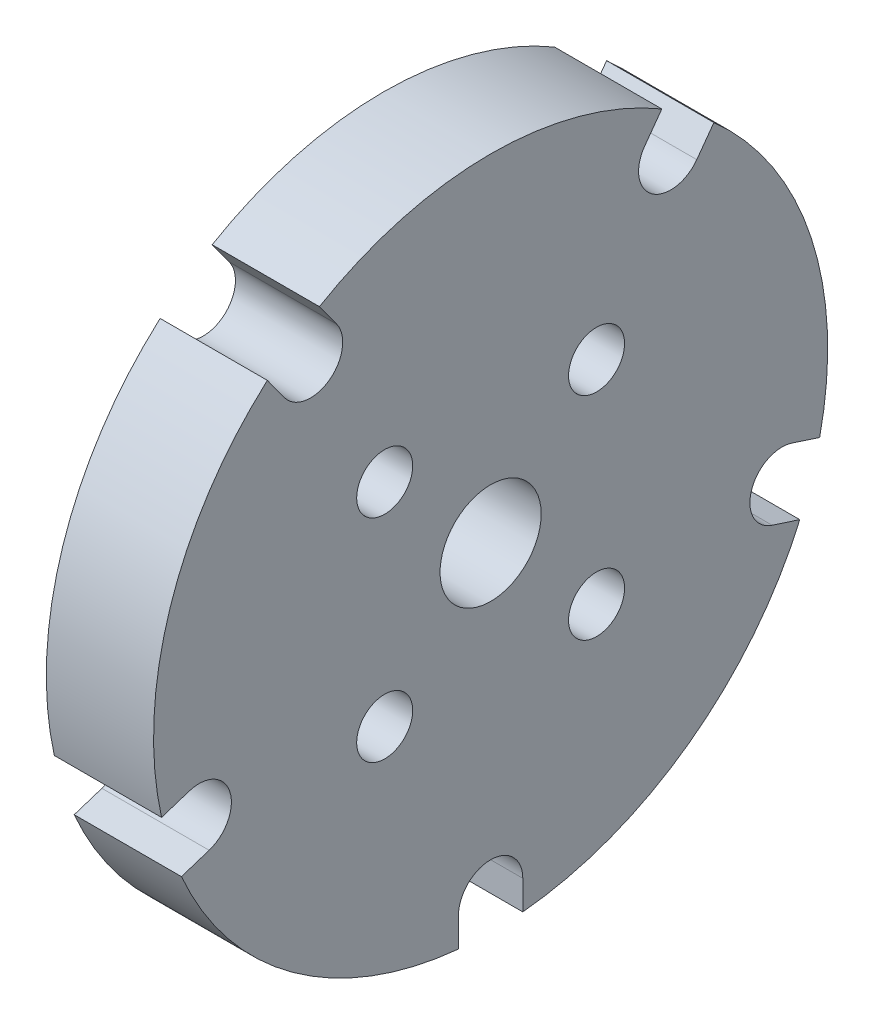
from build123d import *

# Parameters (mm, degrees)
ESQUISSE1_R                                      = 22
BOSS_EXTRU_1_DEPTH                               = 7
ENL_V_MAT_EXTRU_1_REACH                          = 33.89
R_P_TITION_CIRCULAIRE1_COUNT                     = 5
ENL_V_MAT_EXTRU_2_REACH                          = 33.89
ESQUISSE6_R                                      = 3.3
CHAMBRAGE_POUR_VIS_T_TE_RONDE_BOMB_E_D           = 3.6576
CHAMBRAGE_POUR_VIS_T_TE_RONDE_BOMB_E_CBORE_D     = 7.54126
CHAMBRAGE_POUR_VIS_T_TE_RONDE_BOMB_E_CBORE_DEPTH = 2.4638


with BuildPart() as part:
    # Esquisse1 → Boss.-Extru.1 (new body)
    with BuildSketch(Plane(origin=(0, 0, 0), x_dir=(0, 0, -1), z_dir=(1, 0, 0))):
        Circle(ESQUISSE1_R)
    extrude(amount=BOSS_EXTRU_1_DEPTH)

    # Esquisse5 → Enlèv. mat.-Extru.1 (cut, up to next)
    with BuildSketch(Plane(origin=(7, 0, 0), x_dir=(0, 0, -1), z_dir=(1, 0, 0)), mode=Mode.PRIVATE) as enl_v_mat_extru_1_sk1:
        with BuildLine():
            Line((2.1, -20), (2.1, -24))
            ThreePointArc((2.1, -24), (0, -26.1), (-2.1, -24))
            Line((-2.1, -24), (-2.1, -20))
            ThreePointArc((-2.1, -20), (0, -17.9), (2.1, -20))
        make_face()
    enl_v_mat_extru_1_tool1 = extrude(enl_v_mat_extru_1_sk1.sketch, amount=-ENL_V_MAT_EXTRU_1_REACH, mode=Mode.PRIVATE) & part.part
    enl_v_mat_extru_1 = enl_v_mat_extru_1_tool1.solids().sort_by_distance((7, -22, 0))[0]
    add(enl_v_mat_extru_1, mode=Mode.SUBTRACT)

    # Répétition circulaire1: Enlèv. mat.-Extru.1 ×5 about axis
    r_p_tition_circulaire1_axis = Axis((0, 0, 0), (1, 0, 0))
    for i in range(1, R_P_TITION_CIRCULAIRE1_COUNT):
        add(enl_v_mat_extru_1.rotate(r_p_tition_circulaire1_axis, i * 360 / R_P_TITION_CIRCULAIRE1_COUNT), mode=Mode.SUBTRACT)

    # Esquisse6 → Enlèv. mat.-Extru.2 (cut, up to next)
    with BuildSketch(Plane(origin=(7, 0, 0), x_dir=(0, 0, -1), z_dir=(1, 0, 0)), mode=Mode.PRIVATE) as enl_v_mat_extru_2_sk1:
        Circle(ESQUISSE6_R)
    enl_v_mat_extru_2_tool1 = extrude(enl_v_mat_extru_2_sk1.sketch, amount=-ENL_V_MAT_EXTRU_2_REACH, mode=Mode.PRIVATE) & part.part
    add(enl_v_mat_extru_2_tool1.solids().sort_by_distance((7, 0, 0))[0], mode=Mode.SUBTRACT)

    # Chambrage pour vis à tête ronde bombée #61 (through all)
    with Locations(Plane.ZY):
        with Locations((-6.914797213, 6.914797213), (6.914797213, 6.914797213), (6.914797213, -6.914797213), (-6.914797213, -6.914797213)):
            CounterBoreHole(CHAMBRAGE_POUR_VIS_T_TE_RONDE_BOMB_E_D / 2, CHAMBRAGE_POUR_VIS_T_TE_RONDE_BOMB_E_CBORE_D / 2, CHAMBRAGE_POUR_VIS_T_TE_RONDE_BOMB_E_CBORE_DEPTH)


solid = part.part
